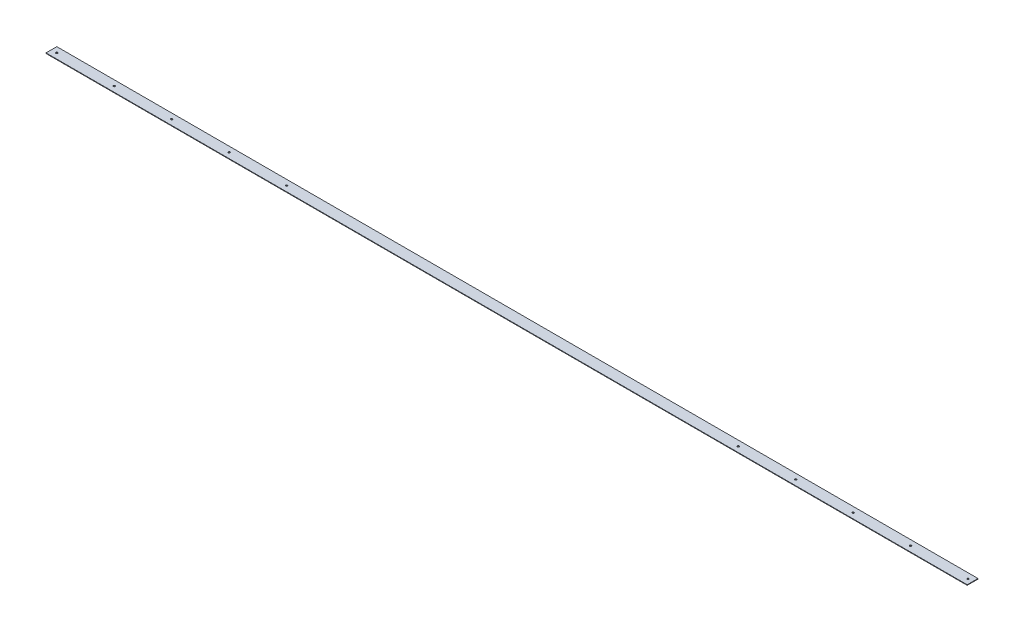
from build123d import *

# Parameters (mm, degrees)
SKETCH1_W           = 3408.5
SKETCH1_H           = 40
BOSS_EXTRUDE1_DEPTH = 2
SKETCH2_R           = 3.4
CUT_EXTRUDE1_DEPTH  = 10


with BuildPart() as part:
    # Sketch1 → Boss-Extrude1 (new body)
    with BuildSketch(Plane(origin=(0, 0, 0), x_dir=(1, 0, 0), z_dir=(0, 1, 0))):
        Rectangle(SKETCH1_W, SKETCH1_H)
    extrude(amount=BOSS_EXTRUDE1_DEPTH)

    # Sketch2 → Cut-Extrude1 (cut)
    with BuildSketch(Plane(origin=(0, 2, 0), x_dir=(1, 0, 0), z_dir=(0, 1, 0))):
        with Locations(Location((-1684.25, 0, 0), (0, 0, 270))):
            Circle(SKETCH2_R)
        with Locations(Location((-1471.75, 0, 0), (0, 0, 270))):
            Circle(SKETCH2_R)
        with Locations(Location((-1259.25, 0, 0), (0, 0, 270))):
            Circle(SKETCH2_R)
        with Locations(Location((-1046.75, 0, 0), (0, 0, 270))):
            Circle(SKETCH2_R)
        with Locations(Location((-834.25, 0, 0), (0, 0, 270))):
            Circle(SKETCH2_R)
        with Locations(Location((1687.25, 0, 0), (0, 0, 270))):
            Circle(SKETCH2_R)
        with Locations(Location((1474.75, 0, 0), (0, 0, 270))):
            Circle(SKETCH2_R)
        with Locations(Location((1262.25, 0, 0), (0, 0, 270))):
            Circle(SKETCH2_R)
        with Locations(Location((1049.75, 0, 0), (0, 0, 270))):
            Circle(SKETCH2_R)
        with Locations(Location((837.25, 0, 0), (0, 0, 270))):
            Circle(SKETCH2_R)
    extrude(amount=-CUT_EXTRUDE1_DEPTH, mode=Mode.SUBTRACT)


solid = part.part
